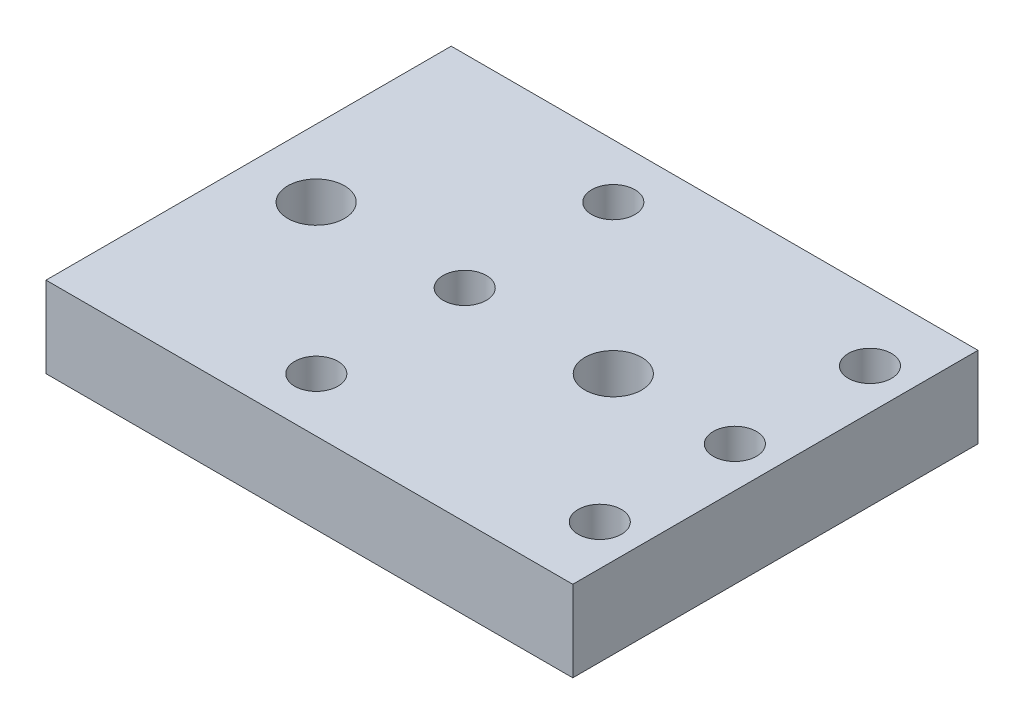
from build123d import *

# Parameters (mm, degrees)
SKETCH_1_W      = 39
SKETCH_1_H      = 30
SKETCH_1_R      = 1.6
SKETCH_1_R_2    = 2.1
EXTRUDE_1_DEPTH = 6


with BuildPart() as part:
    # 草图1 → 凸台-拉伸1 (new body)
    with BuildSketch(Plane(origin=(0, 0, 0), x_dir=(1, 0, 0), z_dir=(0, 1, 0))):
        with Locations((19.5, 15)):
            Rectangle(SKETCH_1_W, SKETCH_1_H)
        with Locations(Location((16, 15, 0), (0, 0, 270))):
            Circle(SKETCH_1_R, mode=Mode.SUBTRACT)
        with Locations(Location((16, 26, 0), (0, 0, 270))):
            Circle(SKETCH_1_R, mode=Mode.SUBTRACT)
        with Locations(Location((5, 15, 0), (0, 0, 270))):
            Circle(SKETCH_1_R_2, mode=Mode.SUBTRACT)
        with Locations(Location((16.01079227, 4.000005294, 0), (0, 0, 90))):
            Circle(SKETCH_1_R, mode=Mode.SUBTRACT)
        with Locations(Location((27, 15, 0), (0, 0, 90))):
            Circle(SKETCH_1_R_2, mode=Mode.SUBTRACT)
        with Locations(Location((36, 25, 0), (0, 0, 270))):
            Circle(SKETCH_1_R, mode=Mode.SUBTRACT)
        with Locations(Location((36, 15, 0), (0, 0, 270))):
            Circle(SKETCH_1_R, mode=Mode.SUBTRACT)
        with Locations(Location((36, 5, 0), (0, 0, 270))):
            Circle(SKETCH_1_R, mode=Mode.SUBTRACT)
    extrude(amount=EXTRUDE_1_DEPTH)


solid = part.part
